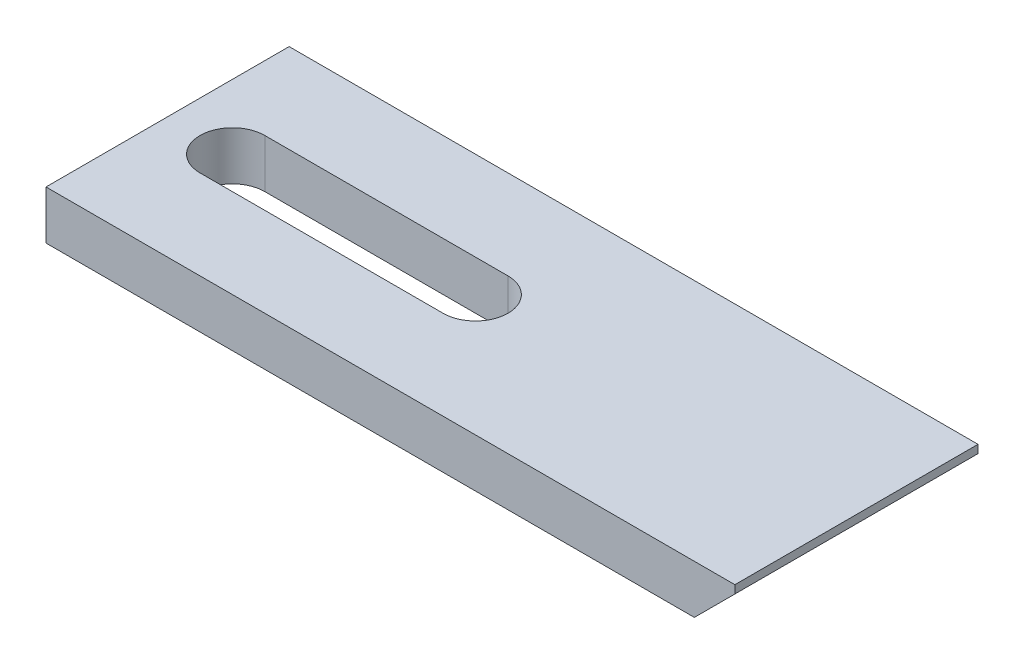
from build123d import *

# Parameters (mm, degrees)
SKETCH_1_W          = 85
SKETCH_1_H          = 30
EXTRUDE_1_DEPTH     = 6
CUT_EXTRUDE_1_DEPTH = 53.366496923
SKETCH_3_W          = 10
SKETCH_3_H          = 8
CUT_EXTRUDE_2_DEPTH = 46.467021015


with BuildPart() as part:
    # Эскиз1 → Бобышка-Вытянуть1 (new body)
    with BuildSketch(Plane(origin=(0, 0, 0), x_dir=(1, 0, 0), z_dir=(0, 1, 0))):
        Rectangle(SKETCH_1_W, SKETCH_1_H)
        with BuildLine():
            Line((-34.5, 4), (-24.5, 4))
            ThreePointArc((-24.5, 4), (-20.5, 0), (-24.5, -4))
            Line((-24.5, -4), (-34.5, -4))
            ThreePointArc((-34.5, -4), (-38.5, 0), (-34.5, 4))
        make_face(mode=Mode.SUBTRACT)
        with BuildLine():
            Line((-4.5, 4), (-14.5, 4))
            ThreePointArc((-14.5, 4), (-18.5, 0), (-14.5, -4))
            Line((-14.5, -4), (-4.5, -4))
            ThreePointArc((-4.5, -4), (-0.5, 0), (-4.5, 4))
        make_face(mode=Mode.SUBTRACT)
    extrude(amount=EXTRUDE_1_DEPTH)

    # Эскиз2 → Вырез-Вытянуть1 (cut, through all)
    with BuildSketch(Plane.XY.offset(15)):
        Polygon((42.5, 5), (37.5, 0), (42.5, 0), align=None)
    extrude(amount=-CUT_EXTRUDE_1_DEPTH, mode=Mode.SUBTRACT)

    # Эскиз3 → Вырез-Вытянуть2 (cut, through all)
    with BuildSketch(Plane(origin=(0, 6, 0), x_dir=(1, 0, 0), z_dir=(0, 1, 0))):
        with Locations((-19.5, 0)):
            Rectangle(SKETCH_3_W, SKETCH_3_H)
    extrude(amount=-CUT_EXTRUDE_2_DEPTH, mode=Mode.SUBTRACT)


solid = part.part
